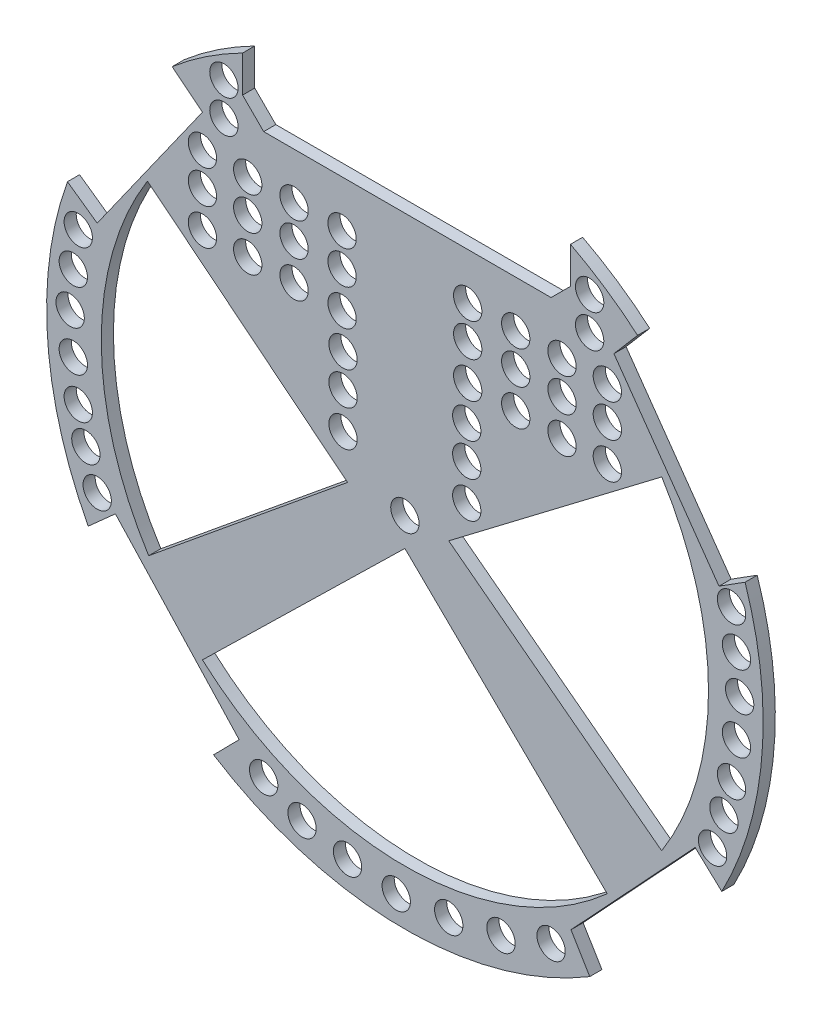
from build123d import *

# Parameters (mm, degrees)
SKETCH1_R           = 3.5
BOSS_EXTRUDE4_DEPTH = 3


with BuildPart() as part:
    # Sketch1 → Boss-Extrude4 (new body)
    with BuildSketch(Plane.XY):
        with BuildLine():
            Line((40.907222951, 78.478335293), (40.907222951, 69.478335293))
            Line((40.907222951, 69.478335293), (36.117637198, 64.68874954))
            Line((36.117637198, 64.68874954), (-34.882362802, 64.68874954))
            Line((-34.882362802, 64.68874954), (-40.091689495, 69.898076234))
            Line((-40.091689495, 69.898076234), (-40.091689495, 78.898076234))
            ThreePointArc((-40.091689495, 78.898076234), (-49.132065099, 73.609035988), (-57.484272884, 67.288991455))
            Line((-57.484272884, 67.288991455), (-50.010639861, 61.271649914))
            Line((-50.010639861, 61.271649914), (-76.007199085, 24.540479112))
            Line((-76.007199085, 24.540479112), (-83.353433246, 29.739790957))
            ThreePointArc((-83.353433246, 29.739790957), (-88.270800728, -6.365197476), (-78.224190194, -41.391135144))
            Line((-78.224190194, -41.391135144), (-71.512419999, -35.395124733))
            Line((-71.512419999, -35.395124733), (-40.940828333, -68.415993634))
            Line((-40.940828333, -68.415993634), (-47.259115036, -74.825303514))
            ThreePointArc((-47.259115036, -74.825303514), (-0.932389989, -88.495088276), (45.672070369, -75.80443251))
            Line((45.672070369, -75.80443251), (41.027453044, -68.09550717))
            Line((41.027453044, -68.09550717), (71.689643186, -35.158748136))
            Line((71.689643186, -35.158748136), (78.276994993, -41.291186165))
            ThreePointArc((78.276994993, -41.291186165), (88.193747334, -7.356149214), (84.035885506, 27.752836742))
            Line((84.035885506, 27.752836742), (77.592312878, 23.684716135))
            Line((77.592312878, 23.684716135), (51.638414625, 60.446043171))
            Line((51.638414625, 60.446043171), (57.484272884, 67.288991455))
            ThreePointArc((57.484272884, 67.288991455), (49.512846485, 73.353445951), (40.907222951, 78.478335293))
        make_face()
        with Locations((-50.010639861, 36.027804692)):
            Circle(SKETCH1_R, mode=Mode.SUBTRACT)
        with Locations((-50.010639861, 44.965616211)):
            Circle(SKETCH1_R, mode=Mode.SUBTRACT)
        with Locations((-50.010639861, 53.137329599)):
            Circle(SKETCH1_R, mode=Mode.SUBTRACT)
        with Locations((-38.818072409, 35.897833432)):
            Circle(SKETCH1_R, mode=Mode.SUBTRACT)
        with Locations((-38.818072409, 44.835644951)):
            Circle(SKETCH1_R, mode=Mode.SUBTRACT)
        with Locations((-38.818072409, 53.007358339)):
            Circle(SKETCH1_R, mode=Mode.SUBTRACT)
        with Locations((-27.380273971, 36.073024906)):
            Circle(SKETCH1_R, mode=Mode.SUBTRACT)
        with Locations((-27.380273971, 45.010836425)):
            Circle(SKETCH1_R, mode=Mode.SUBTRACT)
        with Locations((-27.380273971, 53.182549814)):
            Circle(SKETCH1_R, mode=Mode.SUBTRACT)
        with Locations((-15.519969393, 36.039045095)):
            Circle(SKETCH1_R, mode=Mode.SUBTRACT)
        with Locations((-15.519969393, 44.976856614)):
            Circle(SKETCH1_R, mode=Mode.SUBTRACT)
        with Locations((-15.519969393, 53.148570003)):
            Circle(SKETCH1_R, mode=Mode.SUBTRACT)
        with Locations((-15.286095681, 10.286313721)):
            Circle(SKETCH1_R, mode=Mode.SUBTRACT)
        with Locations((-15.286095681, 19.22412524)):
            Circle(SKETCH1_R, mode=Mode.SUBTRACT)
        with Locations((-15.286095681, 27.395838628)):
            Circle(SKETCH1_R, mode=Mode.SUBTRACT)
        with Locations(Location((15.286095681, 27.395838628, 0), (0, 0, 180))):
            Circle(SKETCH1_R, mode=Mode.SUBTRACT)
        with Locations(Location((15.286095681, 19.22412524, 0), (0, 0, 180))):
            Circle(SKETCH1_R, mode=Mode.SUBTRACT)
        with Locations(Location((15.286095681, 10.286313721, 0), (0, 0, 180))):
            Circle(SKETCH1_R, mode=Mode.SUBTRACT)
        with Locations(Location((15.519969393, 53.148570003, 0), (0, 0, 180))):
            Circle(SKETCH1_R, mode=Mode.SUBTRACT)
        with Locations(Location((15.519969393, 44.976856614, 0), (0, 0, 180))):
            Circle(SKETCH1_R, mode=Mode.SUBTRACT)
        with Locations(Location((15.519969393, 36.039045095, 0), (0, 0, 180))):
            Circle(SKETCH1_R, mode=Mode.SUBTRACT)
        with Locations(Location((27.380273971, 53.182549814, 0), (0, 0, 180))):
            Circle(SKETCH1_R, mode=Mode.SUBTRACT)
        with Locations(Location((27.380273971, 45.010836425, 0), (0, 0, 180))):
            Circle(SKETCH1_R, mode=Mode.SUBTRACT)
        with Locations(Location((27.380273971, 36.073024906, 0), (0, 0, 180))):
            Circle(SKETCH1_R, mode=Mode.SUBTRACT)
        with Locations(Location((38.818072409, 53.007358339, 0), (0, 0, 180))):
            Circle(SKETCH1_R, mode=Mode.SUBTRACT)
        with Locations(Location((38.818072409, 44.835644951, 0), (0, 0, 180))):
            Circle(SKETCH1_R, mode=Mode.SUBTRACT)
        with Locations(Location((38.818072409, 35.897833432, 0), (0, 0, 180))):
            Circle(SKETCH1_R, mode=Mode.SUBTRACT)
        with Locations(Location((50.010639861, 53.137329599, 0), (0, 0, 180))):
            Circle(SKETCH1_R, mode=Mode.SUBTRACT)
        with Locations(Location((50.010639861, 44.965616211, 0), (0, 0, 180))):
            Circle(SKETCH1_R, mode=Mode.SUBTRACT)
        with Locations(Location((50.010639861, 36.027804692, 0), (0, 0, 180))):
            Circle(SKETCH1_R, mode=Mode.SUBTRACT)
        with Locations(Location((45.632189444, 70.091606922, 0), (0, 0, 180))):
            Circle(SKETCH1_R, mode=Mode.SUBTRACT)
        with Locations(Location((45.632189444, 61.919893534, 0), (0, 0, 180))):
            Circle(SKETCH1_R, mode=Mode.SUBTRACT)
        with Locations(Location((-44.706992882, 70.805142898, 0), (0, 0, 180))):
            Circle(SKETCH1_R, mode=Mode.SUBTRACT)
        with Locations(Location((-44.706992882, 62.633429509, 0), (0, 0, 180))):
            Circle(SKETCH1_R, mode=Mode.SUBTRACT)
        with Locations(Location((-80.683898282, 20.806109394, 0), (0, 0, 180))):
            Circle(SKETCH1_R, mode=Mode.SUBTRACT)
        with Locations(Location((-81.906376937, 11.750868753, 0), (0, 0, 180))):
            Circle(SKETCH1_R, mode=Mode.SUBTRACT)
        with Locations(Location((-82.69617398, 2.61178329, 0), (0, 0, 180))):
            Circle(SKETCH1_R, mode=Mode.SUBTRACT)
        with Locations(Location((-81.906376937, -7.043388597, 0), (0, 0, 180))):
            Circle(SKETCH1_R, mode=Mode.SUBTRACT)
        with Locations(Location((-80.683898282, -16.592800559, 0), (0, 0, 180))):
            Circle(SKETCH1_R, mode=Mode.SUBTRACT)
        with Locations(Location((-78.806996032, -24.687731454, 0), (0, 0, 180))):
            Circle(SKETCH1_R, mode=Mode.SUBTRACT)
        with Locations(Location((-76.007199085, -33.147251611, 0), (0, 0, 180))):
            Circle(SKETCH1_R, mode=Mode.SUBTRACT)
        with Locations((76.007199085, -33.147251611)):
            Circle(SKETCH1_R, mode=Mode.SUBTRACT)
        with Locations((78.806996032, -24.687731454)):
            Circle(SKETCH1_R, mode=Mode.SUBTRACT)
        with Locations((80.683898282, -16.592800559)):
            Circle(SKETCH1_R, mode=Mode.SUBTRACT)
        with Locations((81.906376937, -7.043388597)):
            Circle(SKETCH1_R, mode=Mode.SUBTRACT)
        with Locations((82.69617398, 2.61178329)):
            Circle(SKETCH1_R, mode=Mode.SUBTRACT)
        with Locations((81.906376937, 11.750868753)):
            Circle(SKETCH1_R, mode=Mode.SUBTRACT)
        with Locations((80.683898282, 20.806109394)):
            Circle(SKETCH1_R, mode=Mode.SUBTRACT)
        with Locations(Location((-34.882362802, -73.506007736, 0), (0, 0, 180))):
            Circle(SKETCH1_R, mode=Mode.SUBTRACT)
        with Locations(Location((-25.399755691, -77.973845143, 0), (0, 0, 180))):
            Circle(SKETCH1_R, mode=Mode.SUBTRACT)
        with Locations(Location((-2.136188505, -81.979492473, 0), (0, 0, 180))):
            Circle(SKETCH1_R, mode=Mode.SUBTRACT)
        with Locations(Location((0, 0, 0), (0, 0, 180))):
            Circle(SKETCH1_R, mode=Mode.SUBTRACT)
        with Locations(Location((-14.162695034, -80.592922243, 0), (0, 0, 180))):
            Circle(SKETCH1_R, mode=Mode.SUBTRACT)
        with Locations(Location((10.835227364, -80.592922243, 0), (0, 0, 180))):
            Circle(SKETCH1_R, mode=Mode.SUBTRACT)
        with Locations(Location((23.746455781, -77.973845143, 0), (0, 0, 180))):
            Circle(SKETCH1_R, mode=Mode.SUBTRACT)
        with Locations(Location((36.117637198, -73.506007736, 0), (0, 0, 180))):
            Circle(SKETCH1_R, mode=Mode.SUBTRACT)
        with BuildLine():
            Line((10.835227364, 0), (63.452114531, 39.985361841))
            ThreePointArc((63.452114531, 39.985361841), (74.999998004, -0.017304729), (63.433656153, -40.014638159))
            Line((63.433656153, -40.014638159), (10.835227364, 0))
        make_face(mode=Mode.SUBTRACT)
        with BuildLine():
            Line((0, -7.043388597), (-50.013278945, -55.889819549))
            ThreePointArc((-50.013278945, -55.889819549), (-0.017815574, -74.999997884), (49.986721055, -55.913573648))
            Line((49.986721055, -55.913573648), (0, -7.043388597))
        make_face(mode=Mode.SUBTRACT)
        with BuildLine():
            Line((-14.162695034, 0), (-63.289128306, -40.242840832))
            ThreePointArc((-63.289128306, -40.242840832), (-74.999450569, -0.287078916), (-63.59534806, 39.757159168))
            Line((-63.59534806, 39.757159168), (-14.162695034, 0))
        make_face(mode=Mode.SUBTRACT)
    extrude(amount=BOSS_EXTRUDE4_DEPTH)


solid = part.part
